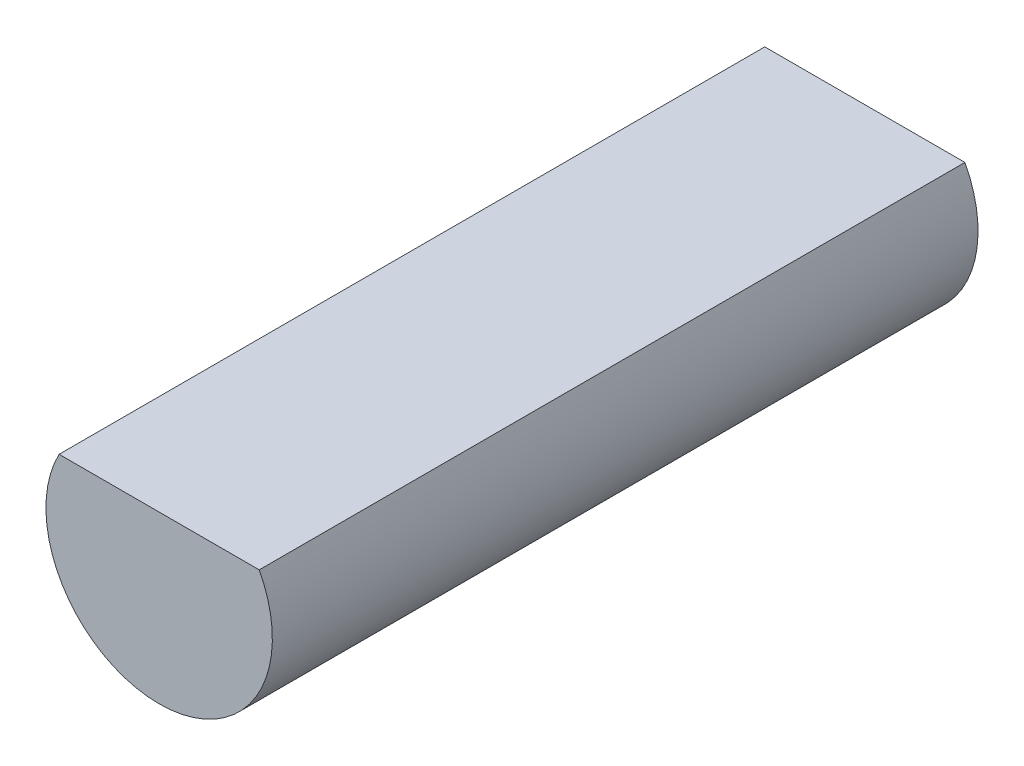
from build123d import *

# Parameters (mm, degrees)
BOSS_EXTRUDE1_DEPTH = 12


with BuildPart() as part:
    # Sketch1 → Boss-Extrude1 (new body)
    with BuildSketch(Plane.XY):
        with BuildLine():
            Line((1.701653608, 0.9), (-1.701653608, 0.9))
            ThreePointArc((-1.701653608, 0.9), (-0.463649547, -1.868329226), (1.925, 0))
            ThreePointArc((1.925, 0), (1.868329226, 0.463649547), (1.701653608, 0.9))
        make_face()
    extrude(amount=BOSS_EXTRUDE1_DEPTH)


solid = part.part
